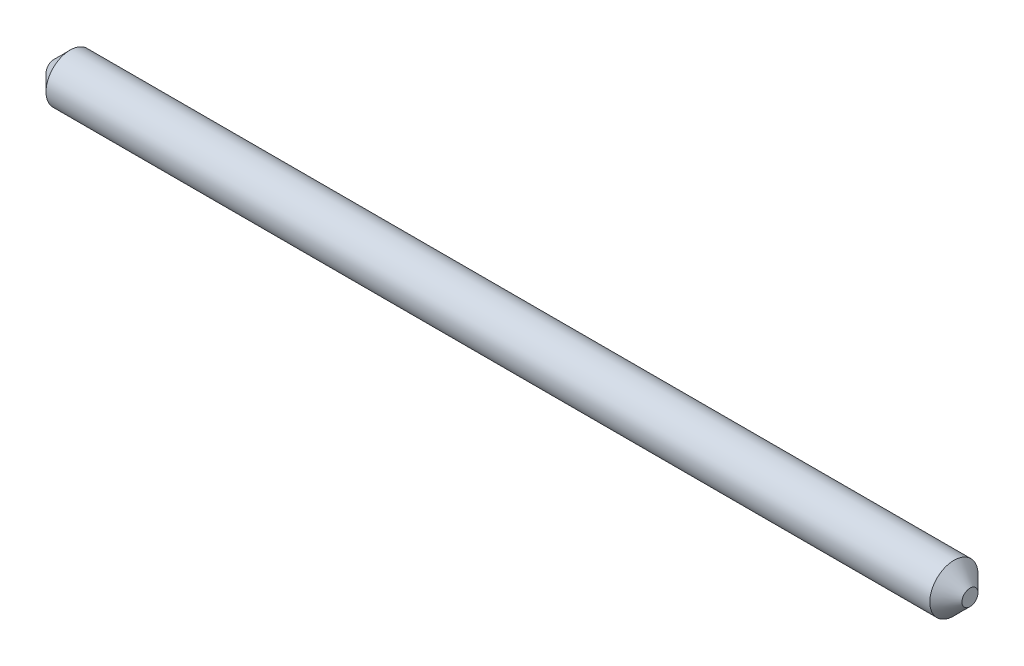
from build123d import *

# Parameters (mm, degrees)
SKETCH1_R           = 1.5
BOSS_EXTRUDE1_DEPTH = 28.5
CHAMFER1_SIZE       = 1


with BuildPart() as part:
    # Sketch1 → Boss-Extrude1 (new, symmetric)
    with BuildSketch(Plane(origin=(0, 0, 0), x_dir=(0, 0, -1), z_dir=(1, 0, 0))):
        with Locations(Location((0, 0, 0), (0, 0, 180))):
            Circle(SKETCH1_R)
    extrude(amount=BOSS_EXTRUDE1_DEPTH, both=True)

    # Chamfer1
    chamfer1_edges = [part.edges().sort_by_distance(p)[0] for p in [
        (-28.5, 0, -1.5),
        (28.5, 0, -1.5),
    ]]
    chamfer(chamfer1_edges, length=CHAMFER1_SIZE)


solid = part.part
